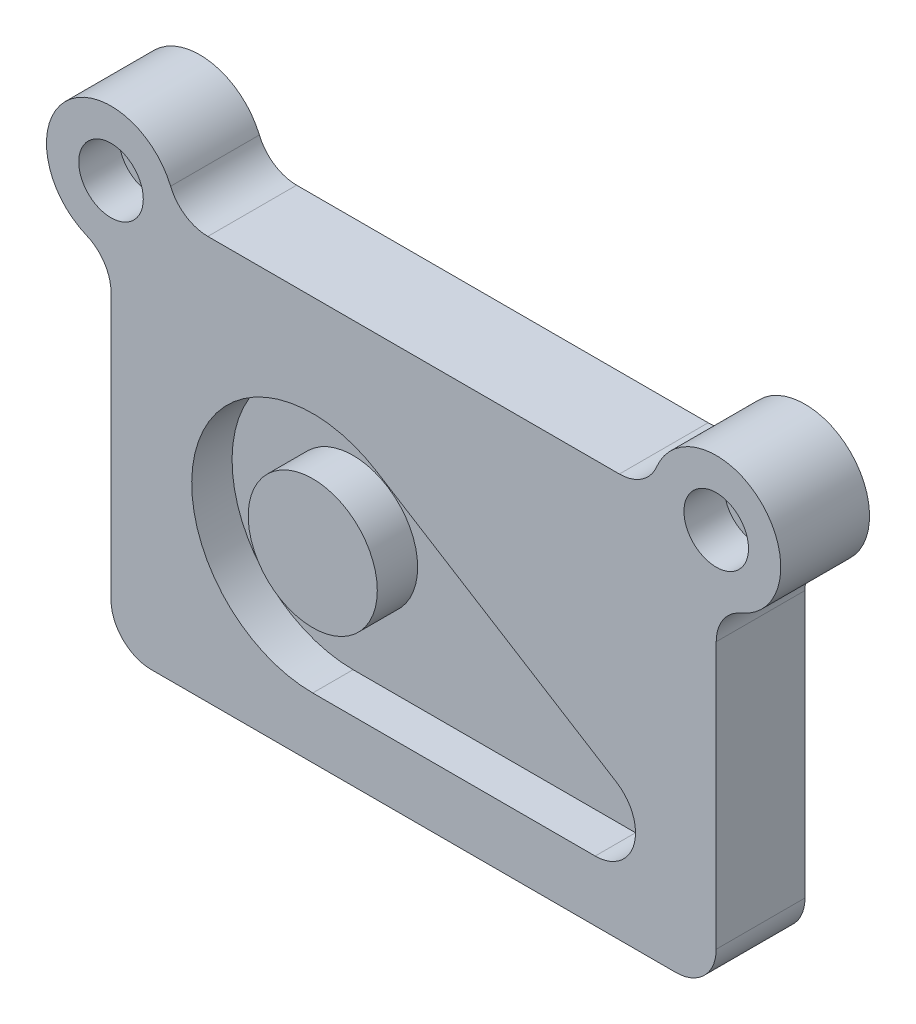
from build123d import *

# Parameters (mm, degrees)
SKETCH4_R          = 3
EXTRUDE1_DEPTH     = 22
SKETCH4_3_R        = 16
CUT_EXTRUDE1_DEPTH = 10
SKETCH4_4_R        = 8
CUT_EXTRUDE2_DEPTH = 10


with BuildPart() as part:
    # Sketch4 → Extrude1 (new body)
    with BuildSketch(Plane.XY):
        with BuildLine():
            Line((126, 100), (24, 100))
            ThreePointArc((24, 100), (18.452998038, 101.679497057), (14.769230769, 106.153846154))
            ThreePointArc((14.769230769, 106.153846154), (-11.313708499, 111.313708499), (-6.153846154, 85.230769231))
            ThreePointArc((-6.153846154, 85.230769231), (-1.679497057, 81.547001962), (0, 76))
            Line((0, 76), (0, 10))
            ThreePointArc((0, 10), (2.928932188, 2.928932188), (10, 0))
            Line((10, 0), (140, 0))
            ThreePointArc((140, 0), (147.071067812, 2.928932188), (150, 10))
            Line((150, 10), (150, 76))
            ThreePointArc((150, 76), (151.679497057, 81.547001962), (156.153846154, 85.230769231))
            ThreePointArc((156.153846154, 85.230769231), (161.313708499, 111.313708499), (135.230769231, 106.153846154))
            ThreePointArc((135.230769231, 106.153846154), (131.547001962, 101.679497057), (126, 100))
        make_face()
        with Locations((0, 100)):
            Circle(SKETCH4_R, mode=Mode.SUBTRACT)
        with Locations((150, 100)):
            Circle(SKETCH4_R, mode=Mode.SUBTRACT)
    extrude(amount=-EXTRUDE1_DEPTH)

    # Sketch4<3> → Cut-Extrude1 (cut)
    with BuildSketch(Plane.XY):
        with BuildLine():
            Line((65.849056604, 70.471698113), (125.283018868, 33.490566038))
            ThreePointArc((125.283018868, 33.490566038), (129.615239476, 22.252788721), (120, 15))
            Line((120, 15), (50, 15))
            ThreePointArc((50, 15), (21.154281571, 53.241633837), (65.849056604, 70.471698113))
        make_face()
        with Locations((50, 45)):
            Circle(SKETCH4_3_R, mode=Mode.SUBTRACT)
    extrude(amount=-CUT_EXTRUDE1_DEPTH, mode=Mode.SUBTRACT)

    # Sketch4<4> → Cut-Extrude2 (cut)
    with BuildSketch(Plane.XY):
        with Locations((0, 100)):
            Circle(SKETCH4_4_R)
        with Locations((150, 100)):
            Circle(SKETCH4_4_R)
    extrude(amount=-CUT_EXTRUDE2_DEPTH, mode=Mode.SUBTRACT)


solid = part.part
